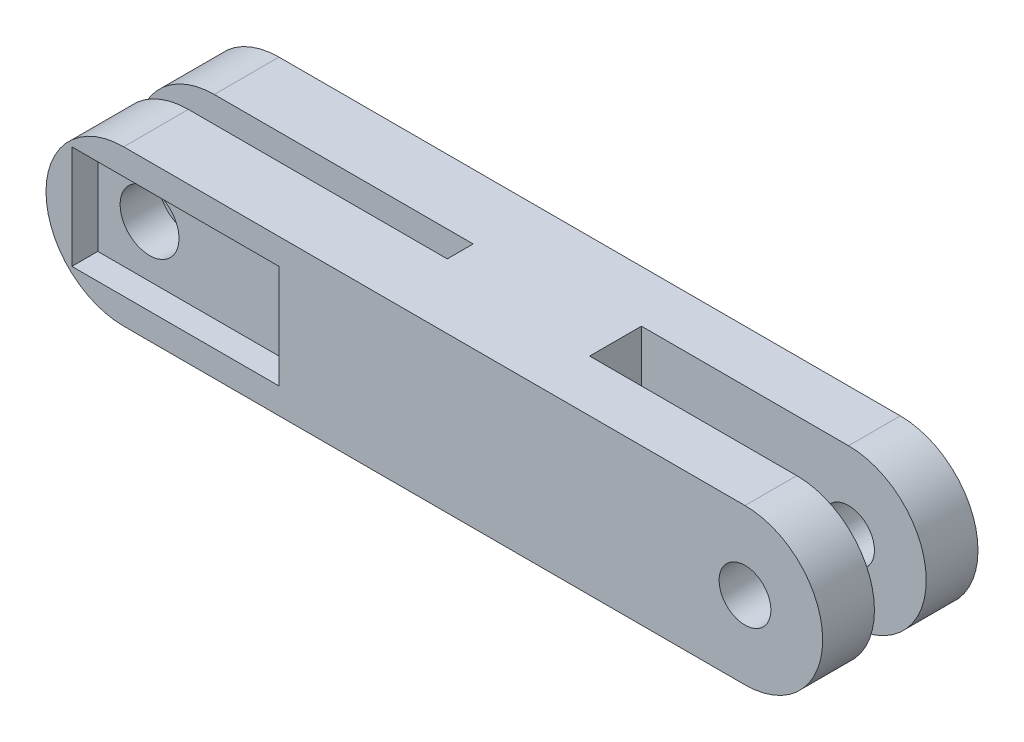
from build123d import *

# Parameters (mm, degrees)
SKETCH1_R               = 6.35
SKETCH1_R_2             = 7.220009846
BOSS_EXTRUDE1_DEPTH     = 38.1
SKETCH2_W               = 50.8
SKETCH2_H               = 25.4
CUT_EXTRUDE1_DEPTH      = 6.35
CUT_EXTRUDE2_DEPTH      = 131.862598214
CUT_EXTRUDE2_DEPTH_BACK = 131.862598214
SKETCH5_W               = 76.2
SKETCH5_H               = 12.7
SKETCH4_W               = 76.2
SKETCH4_H               = 6.35
CUT_EXTRUDE3_DEPTH      = 31.75
SKETCH7_W               = 32.699691946
SKETCH7_H               = 6.35
CUT_EXTRUDE4_DEPTH      = 19.05


with BuildPart() as part:
    # Sketch1 → Boss-Extrude1 (new body)
    with BuildSketch(Plane.XY):
        with BuildLine():
            Line((-104.416317992, 20.723849372), (47.983682008, 20.723849372))
            ThreePointArc((47.983682008, 20.723849372), (67.033682008, 1.673849372), (47.983682008, -17.376150628))
            Line((47.983682008, -17.376150628), (-104.416317992, -17.376150628))
            ThreePointArc((-104.416317992, -17.376150628), (-123.466317992, 1.673849372), (-104.416317992, 20.723849372))
        make_face()
        with Locations(Location((47.983682008, 1.673849372, 0), (0, 0, 180))):
            Circle(SKETCH1_R, mode=Mode.SUBTRACT)
        with Locations(Location((-104.416317992, 1.673849372, 0), (0, 0, 180))):
            Circle(SKETCH1_R_2, mode=Mode.SUBTRACT)
    extrude(amount=BOSS_EXTRUDE1_DEPTH)

    # Sketch2 → Cut-Extrude1 (cut)
    with BuildSketch(Plane.XY.offset(38.1)):
        with Locations((-91.716317992, 1.673849372)):
            Rectangle(SKETCH2_W, SKETCH2_H)
    extrude(amount=-CUT_EXTRUDE1_DEPTH, mode=Mode.SUBTRACT)

    # Sketch5 → Cut-Extrude2 (cut, two sides: drawn at the far end of the back side and taken through both)
    with BuildSketch(Plane(origin=(0, 0, 0), x_dir=(1, 0, 0), z_dir=(0, 1, 0)).offset(-CUT_EXTRUDE2_DEPTH_BACK)):
        with Locations((35.283682008, -19.05)):
            Rectangle(SKETCH5_W, SKETCH5_H)
    extrude(amount=CUT_EXTRUDE2_DEPTH + CUT_EXTRUDE2_DEPTH_BACK, mode=Mode.SUBTRACT)

    # Sketch4 → Cut-Extrude3 (cut)
    with BuildSketch(Plane(origin=(0, 20.723849372, 0), x_dir=(1, 0, 0), z_dir=(0, 1, 0))):
        with Locations((-79.016317992, -19.05)):
            Rectangle(SKETCH4_W, SKETCH4_H)
    extrude(amount=-CUT_EXTRUDE3_DEPTH, mode=Mode.SUBTRACT)

    # Sketch7 → Cut-Extrude4 (cut)
    with BuildSketch(Plane(origin=(0, 20.723849372, 0), x_dir=(1, 0, 0), z_dir=(0, 1, 0))):
        with Locations((-118.381657109, -19.05)):
            Rectangle(SKETCH7_W, SKETCH7_H)
    extrude(amount=-CUT_EXTRUDE4_DEPTH, mode=Mode.SUBTRACT)


solid = part.part
